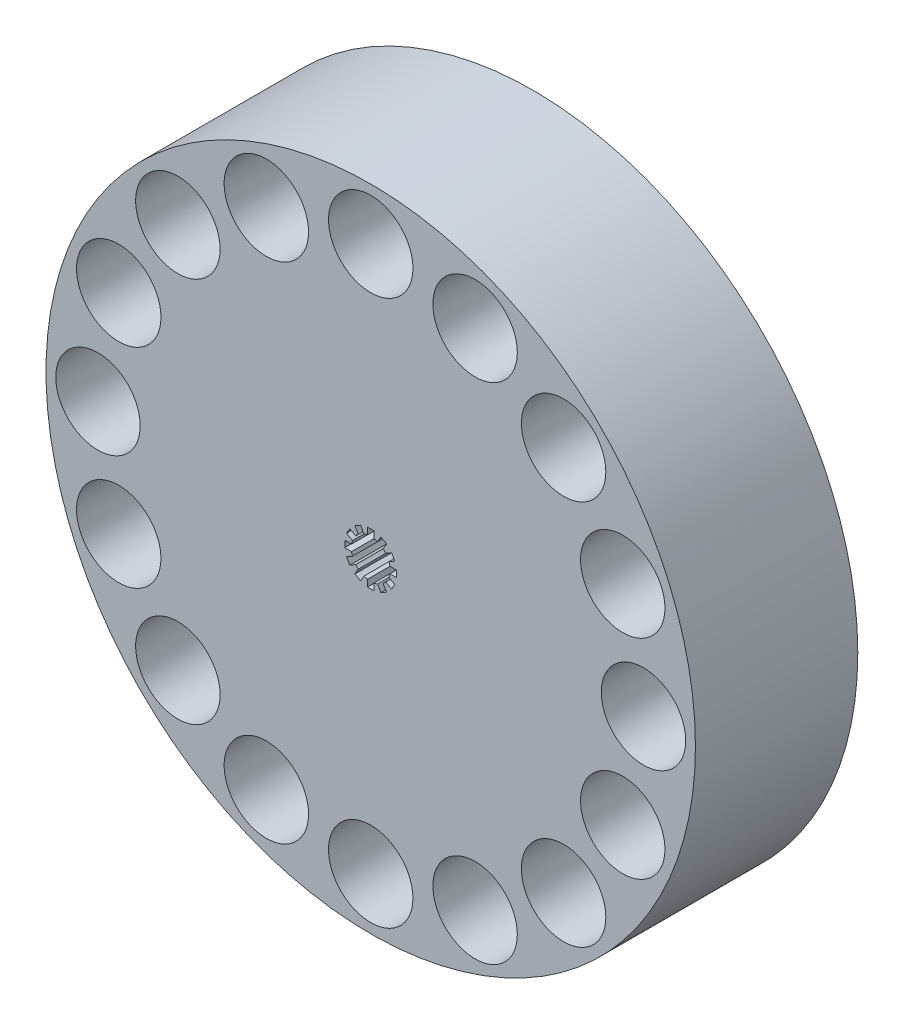
from build123d import *

# Parameters (mm, degrees)
SKETCH2_R           = 50
SKETCH2_R_2         = 6.5
BOSS_EXTRUDE1_DEPTH = 25
CUT_EXTRUDE1_DEPTH  = 76


with BuildPart() as part:
    # Sketch2 → Boss-Extrude1 (new body)
    with BuildSketch(Plane(origin=(0, 0, 0), x_dir=(0, 1, 0), z_dir=(0, 0, 1))):
        with Locations(Location((0, 0, 0), (0, 0, 270))):
            Circle(SKETCH2_R)
        with Locations(Location((0, 42, 0), (0, 0, 270))):
            Circle(SKETCH2_R_2, mode=Mode.SUBTRACT)
        with Locations(Location((29.69848481, 29.69848481, 0), (0, 0, 270))):
            Circle(SKETCH2_R_2, mode=Mode.SUBTRACT)
        with Locations(Location((42, 0, 0), (0, 0, 270))):
            Circle(SKETCH2_R_2, mode=Mode.SUBTRACT)
        with Locations(Location((29.69848481, -29.69848481, 0), (0, 0, 270))):
            Circle(SKETCH2_R_2, mode=Mode.SUBTRACT)
        with Locations(Location((0, -42, 0), (0, 0, 270))):
            Circle(SKETCH2_R_2, mode=Mode.SUBTRACT)
        with Locations(Location((-29.69848481, -29.69848481, 0), (0, 0, 270))):
            Circle(SKETCH2_R_2, mode=Mode.SUBTRACT)
        with Locations(Location((-42, 0, 0), (0, 0, 270))):
            Circle(SKETCH2_R_2, mode=Mode.SUBTRACT)
        with Locations(Location((-29.69848481, 29.69848481, 0), (0, 0, 270))):
            Circle(SKETCH2_R_2, mode=Mode.SUBTRACT)
        with Locations(Location((-38.802940365, 16.072704159, 0), (0, 0, 270))):
            Circle(SKETCH2_R_2, mode=Mode.SUBTRACT)
        with Locations(Location((-16.072704159, 38.802940365, 0), (0, 0, 270))):
            Circle(SKETCH2_R_2, mode=Mode.SUBTRACT)
        with Locations(Location((16.072704159, 38.802940365, 0), (0, 0, 270))):
            Circle(SKETCH2_R_2, mode=Mode.SUBTRACT)
        with Locations(Location((38.802940365, 16.072704159, 0), (0, 0, 270))):
            Circle(SKETCH2_R_2, mode=Mode.SUBTRACT)
        with Locations(Location((38.802940365, -16.072704159, 0), (0, 0, 270))):
            Circle(SKETCH2_R_2, mode=Mode.SUBTRACT)
        with Locations(Location((16.072704159, -38.802940365, 0), (0, 0, 270))):
            Circle(SKETCH2_R_2, mode=Mode.SUBTRACT)
        with Locations(Location((-16.072704159, -38.802940365, 0), (0, 0, 270))):
            Circle(SKETCH2_R_2, mode=Mode.SUBTRACT)
        with Locations(Location((-38.802940365, -16.072704159, 0), (0, 0, 270))):
            Circle(SKETCH2_R_2, mode=Mode.SUBTRACT)
    extrude(amount=BOSS_EXTRUDE1_DEPTH)

    # Sketch4 → Cut-Extrude1 (cut, through all)
    with BuildSketch(Plane.XY.offset(25)):
        with BuildLine():
            Line((-0.5, 4), (0.5, 4))
            Line((0.5, 4), (0.5, 2.958039892))
            ThreePointArc((0.5, 2.958039892), (0.776457135, 2.897777479), (1.046007244, 2.811737691))
            Line((1.046007244, 2.811737691), (1.566987298, 3.714101615))
            Line((1.566987298, 3.714101615), (2.433012702, 3.214101615))
            Line((2.433012702, 3.214101615), (1.912032648, 2.311737691))
            ThreePointArc((1.912032648, 2.311737691), (2.121320344, 2.121320344), (2.311737691, 1.912032648))
            Line((2.311737691, 1.912032648), (3.214101615, 2.433012702))
            Line((3.214101615, 2.433012702), (3.714101615, 1.566987298))
            Line((3.714101615, 1.566987298), (2.811737691, 1.046007244))
            ThreePointArc((2.811737691, 1.046007244), (2.897777479, 0.776457135), (2.958039892, 0.5))
            Line((2.958039892, 0.5), (4, 0.5))
            Line((4, 0.5), (4, -0.5))
            Line((4, -0.5), (2.958039892, -0.5))
            ThreePointArc((2.958039892, -0.5), (2.897777479, -0.776457135), (2.811737691, -1.046007244))
            Line((2.811737691, -1.046007244), (3.714101615, -1.566987298))
            Line((3.714101615, -1.566987298), (3.214101615, -2.433012702))
            Line((3.214101615, -2.433012702), (2.311737691, -1.912032648))
            ThreePointArc((2.311737691, -1.912032648), (2.121320344, -2.121320344), (1.912032648, -2.311737691))
            Line((1.912032648, -2.311737691), (2.433012702, -3.214101615))
            Line((2.433012702, -3.214101615), (1.566987298, -3.714101615))
            Line((1.566987298, -3.714101615), (1.046007244, -2.811737691))
            ThreePointArc((1.046007244, -2.811737691), (0.776457135, -2.897777479), (0.5, -2.958039892))
            Line((0.5, -2.958039892), (0.5, -4))
            Line((0.5, -4), (-0.5, -4))
            Line((-0.5, -4), (-0.5, -2.958039892))
            ThreePointArc((-0.5, -2.958039892), (-0.776457135, -2.897777479), (-1.046007244, -2.811737691))
            Line((-1.046007244, -2.811737691), (-1.566987298, -3.714101615))
            Line((-1.566987298, -3.714101615), (-2.433012702, -3.214101615))
            Line((-2.433012702, -3.214101615), (-1.912032648, -2.311737691))
            ThreePointArc((-1.912032648, -2.311737691), (-2.121320344, -2.121320344), (-2.311737691, -1.912032648))
            Line((-2.311737691, -1.912032648), (-3.214101615, -2.433012702))
            Line((-3.214101615, -2.433012702), (-3.714101615, -1.566987298))
            Line((-3.714101615, -1.566987298), (-2.811737691, -1.046007244))
            ThreePointArc((-2.811737691, -1.046007244), (-2.897777479, -0.776457135), (-2.958039892, -0.5))
            Line((-2.958039892, -0.5), (-4, -0.5))
            Line((-4, -0.5), (-4, 0.5))
            Line((-4, 0.5), (-2.958039892, 0.5))
            ThreePointArc((-2.958039892, 0.5), (-2.897777479, 0.776457135), (-2.811737691, 1.046007244))
            Line((-2.811737691, 1.046007244), (-3.714101615, 1.566987298))
            Line((-3.714101615, 1.566987298), (-3.214101615, 2.433012702))
            Line((-3.214101615, 2.433012702), (-2.311737691, 1.912032648))
            ThreePointArc((-2.311737691, 1.912032648), (-2.121320344, 2.121320344), (-1.912032648, 2.311737691))
            Line((-1.912032648, 2.311737691), (-2.433012702, 3.214101615))
            Line((-2.433012702, 3.214101615), (-1.566987298, 3.714101615))
            Line((-1.566987298, 3.714101615), (-1.046007244, 2.811737691))
            ThreePointArc((-1.046007244, 2.811737691), (-0.776457135, 2.897777479), (-0.5, 2.958039892))
            Line((-0.5, 2.958039892), (-0.5, 4))
        make_face()
    extrude(amount=-CUT_EXTRUDE1_DEPTH, mode=Mode.SUBTRACT)


solid = part.part
